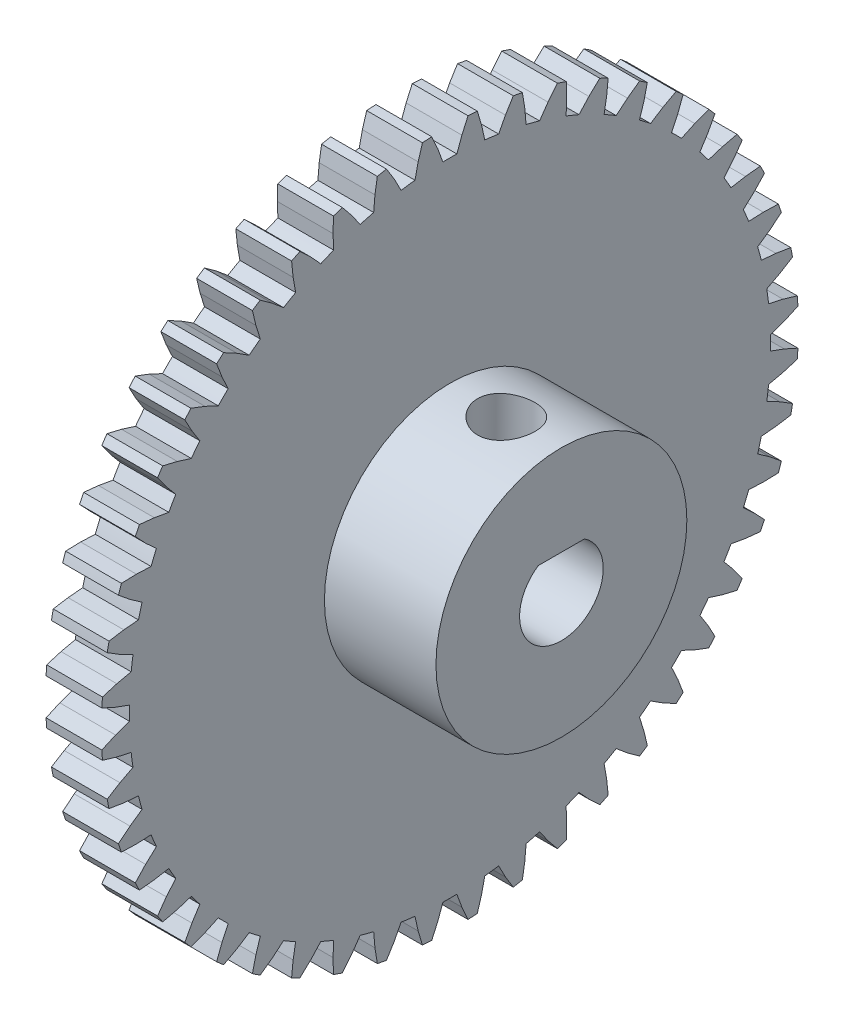
from build123d import *

# Parameters (mm, degrees)
BOSS_EXTRUDE1_DEPTH      = 2
SKETCH2_W                = 4
SKETCH2_H                = 4.5
F_3_0_3_DIAMETER_HOLE1_D = 3
BOSS_EXTRUDE2_START      = -6
BOSS_EXTRUDE2_DEPTH      = 6
SKETCH5_W                = 1.025
SKETCH5_H                = 3.404840194


with BuildPart() as part:
    # Sketch1 → Boss-Extrude1 (new body)
    with BuildSketch(Plane(origin=(2, 0, 0), x_dir=(0, 0, -1), z_dir=(1, 0, 0))):
        with BuildLine():
            Line((-11.497263311, -0.250871178), (-11.992256243, -0.431033871))
            Line((-11.992256243, -0.431033871), (-12.483028281, -0.651156621))
            ThreePointArc((-12.483028281, -0.651156621), (-12.473236541, -0.817539115), (-12.461227238, -0.983776262))
            Line((-12.461227238, -0.983776262), (-11.945922039, -1.137957227))
            Line((-11.945922039, -1.137957227), (-11.43164789, -1.251969061))
            ThreePointArc((-11.43164789, -1.251969061), (-11.401615906, -1.50105121), (-11.366157371, -1.749418939))
            Line((-11.366157371, -1.749418939), (-11.833399619, -1.99264986))
            Line((-11.833399619, -1.99264986), (-12.291241249, -2.274948035))
            ThreePointArc((-12.291241249, -2.274948035), (-12.259816005, -2.438629025), (-12.226211142, -2.601876461))
            Line((-12.226211142, -2.601876461), (-11.695189796, -2.687477561))
            Line((-11.695189796, -2.687477561), (-11.170433803, -2.733387762))
            ThreePointArc((-11.170433803, -2.733387762), (-11.108147002, -2.976419018), (-11.040573326, -3.21803366))
            Line((-11.040573326, -3.21803366), (-11.472070246, -3.520171058))
            Line((-11.472070246, -3.520171058), (-11.889147672, -3.859814457))
            ThreePointArc((-11.889147672, -3.859814457), (-11.836626619, -4.017993316), (-11.782001183, -4.175457834))
            Line((-11.782001183, -4.175457834), (-11.244349613, -4.191014409))
            Line((-11.244349613, -4.191014409), (-10.718090497, -4.16803744))
            ThreePointArc((-10.718090497, -4.16803744), (-10.624614624, -4.400859471), (-10.52608201, -4.631586932))
            Line((-10.52608201, -4.631586932), (-10.91445057, -4.987461152))
            Line((-10.91445057, -4.987461152), (-11.283627481, -5.378638384))
            ThreePointArc((-11.283627481, -5.378638384), (-11.210909269, -5.528608628), (-11.136197918, -5.677595965))
            Line((-11.136197918, -5.677595965), (-10.601115491, -5.622841839))
            Line((-10.601115491, -5.622841839), (-10.082357691, -5.531370843))
            ThreePointArc((-10.082357691, -5.531370843), (-9.959292144, -5.75), (-9.831486513, -5.965892468))
            Line((-9.831486513, -5.965892468), (-10.17008162, -6.369414404))
            Line((-10.17008162, -6.369414404), (-10.485041297, -6.805432316))
            ThreePointArc((-10.485041297, -6.805432316), (-10.393370154, -6.944627913), (-10.299851218, -7.082588855))
            Line((-10.299851218, -7.082588855), (-9.776493344, -6.958460886))
            Line((-9.776493344, -6.958460886), (-9.274112949, -6.800060956))
            ThreePointArc((-9.274112949, -6.800060956), (-9.123563413, -7.000756433), (-8.968671556, -7.19811993))
            Line((-8.968671556, -7.19811993), (-9.251699753, -7.642385209))
            Line((-9.251699753, -7.642385209), (-9.507053148, -8.115783415))
            ThreePointArc((-9.507053148, -8.115783415), (-9.397997593, -8.241822689), (-9.287271209, -8.366396686))
            Line((-9.287271209, -8.366396686), (-8.784592685, -8.175018738))
            Line((-8.784592685, -8.175018738), (-8.307185564, -7.952400141))
            ThreePointArc((-8.307185564, -7.952400141), (-8.131727984, -8.131727984), (-7.952400141, -8.307185564))
            Line((-7.952400141, -8.307185564), (-8.175018738, -8.784592685))
            Line((-8.175018738, -8.784592685), (-8.366396684, -9.28727121))
            ThreePointArc((-8.366396684, -9.28727121), (-8.241822688, -9.397997595), (-8.115783413, -9.50705315))
            Line((-8.115783413, -9.50705315), (-7.642385209, -9.251699753))
            Line((-7.642385209, -9.251699753), (-7.19811993, -8.968671556))
            ThreePointArc((-7.19811993, -8.968671556), (-7.000756433, -9.123563414), (-6.800060955, -9.27411295))
            Line((-6.800060955, -9.27411295), (-6.958460886, -9.776493344))
            Line((-6.958460886, -9.776493344), (-7.082588854, -10.299851219))
            ThreePointArc((-7.082588854, -10.299851219), (-6.944627914, -10.393370153), (-6.805432319, -10.485041295))
            Line((-6.805432319, -10.485041295), (-6.369414404, -10.17008162))
            Line((-6.369414404, -10.17008162), (-5.965892469, -9.831486513))
            ThreePointArc((-5.965892469, -9.831486513), (-5.749999999, -9.959292144), (-5.531370841, -10.082357691))
            Line((-5.531370841, -10.082357691), (-5.622841839, -10.601115491))
            Line((-5.622841839, -10.601115491), (-5.677595964, -11.136197918))
            ThreePointArc((-5.677595964, -11.136197918), (-5.528608629, -11.210909269), (-5.378638386, -11.28362748))
            Line((-5.378638386, -11.28362748), (-4.987461152, -10.91445057))
            Line((-4.987461152, -10.91445057), (-4.631586933, -10.52608201))
            ThreePointArc((-4.631586933, -10.52608201), (-4.400859471, -10.624614624), (-4.168037438, -10.718090498))
            Line((-4.168037438, -10.718090498), (-4.191014409, -11.244349613))
            Line((-4.191014409, -11.244349613), (-4.175457834, -11.782001183))
            ThreePointArc((-4.175457834, -11.782001183), (-4.017993317, -11.836626618), (-3.859814459, -11.889147671))
            Line((-3.859814459, -11.889147671), (-3.520171058, -11.472070246))
            Line((-3.520171058, -11.472070246), (-3.218033661, -11.040573325))
            ThreePointArc((-3.218033661, -11.040573325), (-2.97641902, -11.108147002), (-2.733387765, -11.170433802))
            Line((-2.733387765, -11.170433802), (-2.687477561, -11.695189796))
            Line((-2.687477561, -11.695189796), (-2.601876462, -12.226211142))
            ThreePointArc((-2.601876462, -12.226211142), (-2.438629026, -12.259816005), (-2.274948036, -12.291241249))
            Line((-2.274948036, -12.291241249), (-1.99264986, -11.833399619))
            Line((-1.99264986, -11.833399619), (-1.749418941, -11.36615737))
            ThreePointArc((-1.749418941, -11.36615737), (-1.501051212, -11.401615906), (-1.251969063, -11.431647889))
            Line((-1.251969063, -11.431647889), (-1.137957227, -11.945922038))
            Line((-1.137957227, -11.945922038), (-0.983776263, -12.461227238))
            ThreePointArc((-0.983776263, -12.461227238), (-0.817539116, -12.473236541), (-0.651156622, -12.483028281))
            Line((-0.651156622, -12.483028281), (-0.431033871, -11.992256243))
            Line((-0.431033871, -11.992256243), (-0.250871178, -11.497263311))
            ThreePointArc((-0.250871178, -11.497263311), (-1e-09, -11.5), (0.250871176, -11.497263311))
            Line((0.250871176, -11.497263311), (0.431033871, -11.992256243))
            Line((0.431033871, -11.992256243), (0.651156621, -12.483028281))
            ThreePointArc((0.651156621, -12.483028281), (0.817539115, -12.473236541), (0.983776263, -12.461227238))
            Line((0.983776263, -12.461227238), (1.137957227, -11.945922038))
            Line((1.137957227, -11.945922038), (1.251969061, -11.431647889))
            ThreePointArc((1.251969061, -11.431647889), (1.50105121, -11.401615906), (1.74941894, -11.36615737))
            Line((1.74941894, -11.36615737), (1.99264986, -11.833399619))
            Line((1.99264986, -11.833399619), (2.274948035, -12.291241249))
            ThreePointArc((2.274948035, -12.291241249), (2.438629025, -12.259816005), (2.601876463, -12.226211141))
            Line((2.601876463, -12.226211141), (2.687477561, -11.695189796))
            Line((2.687477561, -11.695189796), (2.733387762, -11.170433803))
            ThreePointArc((2.733387762, -11.170433803), (2.976419018, -11.108147002), (3.218033661, -11.040573325))
            Line((3.218033661, -11.040573325), (3.520171058, -11.472070246))
            Line((3.520171058, -11.472070246), (3.859814457, -11.889147672))
            ThreePointArc((3.859814457, -11.889147672), (4.017993317, -11.836626619), (4.175457835, -11.782001183))
            Line((4.175457835, -11.782001183), (4.191014409, -11.244349613))
            Line((4.191014409, -11.244349613), (4.16803744, -10.718090497))
            ThreePointArc((4.16803744, -10.718090497), (4.400859472, -10.624614624), (4.631586933, -10.52608201))
            Line((4.631586933, -10.52608201), (4.987461152, -10.91445057))
            Line((4.987461152, -10.91445057), (5.378638384, -11.283627481))
            ThreePointArc((5.378638384, -11.283627481), (5.528608629, -11.210909269), (5.677595966, -11.136197917))
            Line((5.677595966, -11.136197917), (5.622841839, -10.601115491))
            Line((5.622841839, -10.601115491), (5.531370843, -10.08235769))
            ThreePointArc((5.531370843, -10.08235769), (5.75, -9.959292143), (5.965892469, -9.831486512))
            Line((5.965892469, -9.831486512), (6.369414404, -10.17008162))
            Line((6.369414404, -10.17008162), (6.805432316, -10.485041296))
            ThreePointArc((6.805432316, -10.485041296), (6.944627914, -10.393370153), (7.082588856, -10.299851217))
            Line((7.082588856, -10.299851217), (6.958460886, -9.776493344))
            Line((6.958460886, -9.776493344), (6.800060956, -9.274112949))
            ThreePointArc((6.800060956, -9.274112949), (7.000756434, -9.123563413), (7.198119931, -8.968671555))
            Line((7.198119931, -8.968671555), (7.642385209, -9.251699753))
            Line((7.642385209, -9.251699753), (8.115783415, -9.507053148))
            ThreePointArc((8.115783415, -9.507053148), (8.241822687, -9.397997595), (8.366396682, -9.287271212))
            Line((8.366396682, -9.287271212), (8.175018738, -8.784592685))
            Line((8.175018738, -8.784592685), (7.952400141, -8.307185564))
            ThreePointArc((7.952400141, -8.307185564), (8.131727984, -8.131727983), (8.307185565, -7.95240014))
            Line((8.307185565, -7.95240014), (8.784592685, -8.175018738))
            Line((8.784592685, -8.175018738), (9.28727121, -8.366396684))
            ThreePointArc((9.28727121, -8.366396684), (9.397997593, -8.24182269), (9.507053146, -8.115783417))
            Line((9.507053146, -8.115783417), (9.251699753, -7.642385209))
            Line((9.251699753, -7.642385209), (8.968671556, -7.19811993))
            ThreePointArc((8.968671556, -7.19811993), (9.123563414, -7.000756432), (9.27411295, -6.800060954))
            Line((9.27411295, -6.800060954), (9.776493344, -6.958460886))
            Line((9.776493344, -6.958460886), (10.299851219, -7.082588854))
            ThreePointArc((10.299851219, -7.082588854), (10.393370153, -6.944627914), (10.485041295, -6.805432318))
            Line((10.485041295, -6.805432318), (10.17008162, -6.369414404))
            Line((10.17008162, -6.369414404), (9.831486513, -5.965892469))
            ThreePointArc((9.831486513, -5.965892469), (9.959292143, -5.750000001), (10.082357689, -5.531370845))
            Line((10.082357689, -5.531370845), (10.601115491, -5.622841839))
            Line((10.601115491, -5.622841839), (11.136197918, -5.677595964))
            ThreePointArc((11.136197918, -5.677595964), (11.210909269, -5.528608628), (11.283627481, -5.378638385))
            Line((11.283627481, -5.378638385), (10.91445057, -4.987461152))
            Line((10.91445057, -4.987461152), (10.52608201, -4.631586933))
            ThreePointArc((10.52608201, -4.631586933), (10.624614623, -4.400859473), (10.718090496, -4.168037442))
            Line((10.718090496, -4.168037442), (11.244349613, -4.191014409))
            Line((11.244349613, -4.191014409), (11.782001183, -4.175457834))
            ThreePointArc((11.782001183, -4.175457834), (11.836626619, -4.017993317), (11.889147671, -3.859814458))
            Line((11.889147671, -3.859814458), (11.472070246, -3.520171058))
            Line((11.472070246, -3.520171058), (11.040573325, -3.218033661))
            ThreePointArc((11.040573325, -3.218033661), (11.108147002, -2.976419019), (11.170433802, -2.733387763))
            Line((11.170433802, -2.733387763), (11.695189796, -2.687477561))
            Line((11.695189796, -2.687477561), (12.226211141, -2.601876462))
            ThreePointArc((12.226211141, -2.601876462), (12.259816005, -2.438629025), (12.291241249, -2.274948035))
            Line((12.291241249, -2.274948035), (11.833399619, -1.99264986))
            Line((11.833399619, -1.99264986), (11.36615737, -1.749418941))
            ThreePointArc((11.36615737, -1.749418941), (11.401615906, -1.501051211), (11.431647889, -1.251969062))
            Line((11.431647889, -1.251969062), (11.945922038, -1.137957227))
            Line((11.945922038, -1.137957227), (12.461227237, -0.983776263))
            ThreePointArc((12.461227237, -0.983776263), (12.47323654, -0.817539115), (12.483028281, -0.65115662))
            Line((12.483028281, -0.65115662), (11.992256243, -0.431033871))
            Line((11.992256243, -0.431033871), (11.497263311, -0.250871178))
            ThreePointArc((11.497263311, -0.250871178), (11.5, 0), (11.497263311, 0.250871178))
            Line((11.497263311, 0.250871178), (11.992256243, 0.431033871))
            Line((11.992256243, 0.431033871), (12.483028281, 0.651156622))
            ThreePointArc((12.483028281, 0.651156622), (12.47323654, 0.817539116), (12.461227237, 0.983776263))
            Line((12.461227237, 0.983776263), (11.945922038, 1.137957227))
            Line((11.945922038, 1.137957227), (11.431647889, 1.251969063))
            ThreePointArc((11.431647889, 1.251969063), (11.401615905, 1.501051212), (11.36615737, 1.749418941))
            Line((11.36615737, 1.749418941), (11.833399619, 1.99264986))
            Line((11.833399619, 1.99264986), (12.291241249, 2.274948036))
            ThreePointArc((12.291241249, 2.274948036), (12.259816005, 2.438629026), (12.226211141, 2.601876462))
            Line((12.226211141, 2.601876462), (11.695189796, 2.687477561))
            Line((11.695189796, 2.687477561), (11.170433802, 2.733387764))
            ThreePointArc((11.170433802, 2.733387764), (11.108147002, 2.97641902), (11.040573325, 3.218033661))
            Line((11.040573325, 3.218033661), (11.472070246, 3.520171058))
            Line((11.472070246, 3.520171058), (11.889147671, 3.859814459))
            ThreePointArc((11.889147671, 3.859814459), (11.836626618, 4.017993317), (11.782001183, 4.175457834))
            Line((11.782001183, 4.175457834), (11.244349613, 4.191014409))
            Line((11.244349613, 4.191014409), (10.718090498, 4.168037438))
            ThreePointArc((10.718090498, 4.168037438), (10.624614624, 4.400859471), (10.52608201, 4.631586933))
            Line((10.52608201, 4.631586933), (10.91445057, 4.987461152))
            Line((10.91445057, 4.987461152), (11.28362748, 5.378638386))
            ThreePointArc((11.28362748, 5.378638386), (11.210909269, 5.528608629), (11.136197918, 5.677595964))
            Line((11.136197918, 5.677595964), (10.601115491, 5.622841839))
            Line((10.601115491, 5.622841839), (10.082357691, 5.531370841))
            ThreePointArc((10.082357691, 5.531370841), (9.959292144, 5.749999999), (9.831486513, 5.965892469))
            Line((9.831486513, 5.965892469), (10.17008162, 6.369414404))
            Line((10.17008162, 6.369414404), (10.485041295, 6.805432319))
            ThreePointArc((10.485041295, 6.805432319), (10.393370153, 6.944627914), (10.299851219, 7.082588854))
            Line((10.299851219, 7.082588854), (9.776493344, 6.958460886))
            Line((9.776493344, 6.958460886), (9.27411295, 6.800060955))
            ThreePointArc((9.27411295, 6.800060955), (9.123563414, 7.000756433), (8.968671556, 7.19811993))
            Line((8.968671556, 7.19811993), (9.251699753, 7.642385209))
            Line((9.251699753, 7.642385209), (9.50705315, 8.115783413))
            ThreePointArc((9.50705315, 8.115783413), (9.397997595, 8.241822688), (9.28727121, 8.366396684))
            Line((9.28727121, 8.366396684), (8.784592685, 8.175018738))
            Line((8.784592685, 8.175018738), (8.307185564, 7.952400141))
            ThreePointArc((8.307185564, 7.952400141), (8.131727984, 8.131727983), (7.952400141, 8.307185564))
            Line((7.952400141, 8.307185564), (8.175018738, 8.784592685))
            Line((8.175018738, 8.784592685), (8.366396686, 9.287271208))
            ThreePointArc((8.366396686, 9.287271208), (8.241822689, 9.397997593), (8.115783415, 9.507053148))
            Line((8.115783415, 9.507053148), (7.642385209, 9.251699753))
            Line((7.642385209, 9.251699753), (7.19811993, 8.968671555))
            ThreePointArc((7.19811993, 8.968671555), (7.000756433, 9.123563413), (6.800060956, 9.274112949))
            Line((6.800060956, 9.274112949), (6.958460886, 9.776493344))
            Line((6.958460886, 9.776493344), (7.082588855, 10.299851218))
            ThreePointArc((7.082588855, 10.299851218), (6.944627913, 10.393370153), (6.805432316, 10.485041296))
            Line((6.805432316, 10.485041296), (6.369414404, 10.17008162))
            Line((6.369414404, 10.17008162), (5.965892468, 9.831486513))
            ThreePointArc((5.965892468, 9.831486513), (5.75, 9.959292143), (5.531370843, 10.08235769))
            Line((5.531370843, 10.08235769), (5.622841839, 10.601115491))
            Line((5.622841839, 10.601115491), (5.677595965, 11.136197918))
            ThreePointArc((5.677595965, 11.136197918), (5.528608628, 11.210909269), (5.378638384, 11.283627481))
            Line((5.378638384, 11.283627481), (4.987461152, 10.91445057))
            Line((4.987461152, 10.91445057), (4.631586932, 10.52608201))
            ThreePointArc((4.631586932, 10.52608201), (4.400859471, 10.624614624), (4.16803744, 10.718090497))
            Line((4.16803744, 10.718090497), (4.191014409, 11.244349613))
            Line((4.191014409, 11.244349613), (4.175457834, 11.782001183))
            ThreePointArc((4.175457834, 11.782001183), (4.017993316, 11.836626619), (3.859814457, 11.889147672))
            Line((3.859814457, 11.889147672), (3.520171058, 11.472070246))
            Line((3.520171058, 11.472070246), (3.21803366, 11.040573326))
            ThreePointArc((3.21803366, 11.040573326), (2.976419018, 11.108147002), (2.733387762, 11.170433803))
            Line((2.733387762, 11.170433803), (2.687477561, 11.695189796))
            Line((2.687477561, 11.695189796), (2.601876461, 12.226211142))
            ThreePointArc((2.601876461, 12.226211142), (2.438629025, 12.259816005), (2.274948035, 12.291241249))
            Line((2.274948035, 12.291241249), (1.99264986, 11.833399619))
            Line((1.99264986, 11.833399619), (1.749418939, 11.366157371))
            ThreePointArc((1.749418939, 11.366157371), (1.50105121, 11.401615906), (1.251969061, 11.431647889))
            Line((1.251969061, 11.431647889), (1.137957227, 11.945922038))
            Line((1.137957227, 11.945922038), (0.983776262, 12.461227238))
            ThreePointArc((0.983776262, 12.461227238), (0.817539115, 12.473236541), (0.651156621, 12.483028281))
            Line((0.651156621, 12.483028281), (0.431033871, 11.992256243))
            Line((0.431033871, 11.992256243), (0.250871175, 11.497263311))
            ThreePointArc((0.250871175, 11.497263311), (-1e-09, 11.5), (-0.250871178, 11.497263311))
            Line((-0.250871178, 11.497263311), (-0.431033871, 11.992256243))
            Line((-0.431033871, 11.992256243), (-0.651156623, 12.483028281))
            ThreePointArc((-0.651156623, 12.483028281), (-0.817539116, 12.473236541), (-0.983776263, 12.461227238))
            Line((-0.983776263, 12.461227238), (-1.137957227, 11.945922038))
            Line((-1.137957227, 11.945922038), (-1.251969058, 11.43164789))
            ThreePointArc((-1.251969058, 11.43164789), (-1.501051209, 11.401615906), (-1.749418941, 11.36615737))
            Line((-1.749418941, 11.36615737), (-1.99264986, 11.833399619))
            Line((-1.99264986, 11.833399619), (-2.274948037, 12.291241249))
            ThreePointArc((-2.274948037, 12.291241249), (-2.438629026, 12.259816005), (-2.601876462, 12.226211142))
            Line((-2.601876462, 12.226211142), (-2.687477561, 11.695189796))
            Line((-2.687477561, 11.695189796), (-2.73338776, 11.170433803))
            ThreePointArc((-2.73338776, 11.170433803), (-2.976419018, 11.108147002), (-3.218033661, 11.040573325))
            Line((-3.218033661, 11.040573325), (-3.520171058, 11.472070246))
            Line((-3.520171058, 11.472070246), (-3.85981446, 11.889147671))
            ThreePointArc((-3.85981446, 11.889147671), (-4.017993318, 11.836626618), (-4.175457834, 11.782001183))
            Line((-4.175457834, 11.782001183), (-4.191014409, 11.244349613))
            Line((-4.191014409, 11.244349613), (-4.168037439, 10.718090497))
            ThreePointArc((-4.168037439, 10.718090497), (-4.400859471, 10.624614624), (-4.631586933, 10.52608201))
            Line((-4.631586933, 10.52608201), (-4.987461152, 10.91445057))
            Line((-4.987461152, 10.91445057), (-5.378638382, 11.283627482))
            ThreePointArc((-5.378638382, 11.283627482), (-5.528608627, 11.21090927), (-5.677595964, 11.136197918))
            Line((-5.677595964, 11.136197918), (-5.622841839, 10.601115491))
            Line((-5.622841839, 10.601115491), (-5.531370842, 10.082357691))
            ThreePointArc((-5.531370842, 10.082357691), (-5.75, 9.959292144), (-5.965892469, 9.831486513))
            Line((-5.965892469, 9.831486513), (-6.369414404, 10.17008162))
            Line((-6.369414404, 10.17008162), (-6.805432315, 10.485041298))
            ThreePointArc((-6.805432315, 10.485041298), (-6.944627912, 10.393370154), (-7.082588854, 10.299851219))
            Line((-7.082588854, 10.299851219), (-6.958460886, 9.776493344))
            Line((-6.958460886, 9.776493344), (-6.800060956, 9.274112949))
            ThreePointArc((-6.800060956, 9.274112949), (-7.000756433, 9.123563414), (-7.19811993, 8.968671556))
            Line((-7.19811993, 8.968671556), (-7.642385209, 9.251699753))
            Line((-7.642385209, 9.251699753), (-8.115783414, 9.507053149))
            ThreePointArc((-8.115783414, 9.507053149), (-8.241822688, 9.397997594), (-8.366396684, 9.28727121))
            Line((-8.366396684, 9.28727121), (-8.175018738, 8.784592685))
            Line((-8.175018738, 8.784592685), (-7.952400142, 8.307185564))
            ThreePointArc((-7.952400142, 8.307185564), (-8.131727984, 8.131727983), (-8.307185564, 7.952400141))
            Line((-8.307185564, 7.952400141), (-8.784592685, 8.175018738))
            Line((-8.784592685, 8.175018738), (-9.287271209, 8.366396685))
            ThreePointArc((-9.287271209, 8.366396685), (-9.397997594, 8.241822689), (-9.507053148, 8.115783415))
            Line((-9.507053148, 8.115783415), (-9.251699753, 7.642385209))
            Line((-9.251699753, 7.642385209), (-8.968671556, 7.198119929))
            ThreePointArc((-8.968671556, 7.198119929), (-9.123563414, 7.000756433), (-9.274112949, 6.800060956))
            Line((-9.274112949, 6.800060956), (-9.776493344, 6.958460886))
            Line((-9.776493344, 6.958460886), (-10.299851219, 7.082588854))
            ThreePointArc((-10.299851219, 7.082588854), (-10.393370154, 6.944627913), (-10.485041297, 6.805432316))
            Line((-10.485041297, 6.805432316), (-10.17008162, 6.369414404))
            Line((-10.17008162, 6.369414404), (-9.831486514, 5.965892468))
            ThreePointArc((-9.831486514, 5.965892468), (-9.959292144, 5.749999999), (-10.082357691, 5.531370843))
            Line((-10.082357691, 5.531370843), (-10.601115491, 5.622841839))
            Line((-10.601115491, 5.622841839), (-11.136197918, 5.677595964))
            ThreePointArc((-11.136197918, 5.677595964), (-11.210909269, 5.528608628), (-11.283627481, 5.378638384))
            Line((-11.283627481, 5.378638384), (-10.91445057, 4.987461152))
            Line((-10.91445057, 4.987461152), (-10.526082011, 4.631586931))
            ThreePointArc((-10.526082011, 4.631586931), (-10.624614624, 4.400859471), (-10.718090497, 4.16803744))
            Line((-10.718090497, 4.16803744), (-11.244349613, 4.191014409))
            Line((-11.244349613, 4.191014409), (-11.782001184, 4.175457833))
            ThreePointArc((-11.782001184, 4.175457833), (-11.836626619, 4.017993316), (-11.889147672, 3.859814457))
            Line((-11.889147672, 3.859814457), (-11.472070246, 3.520171058))
            Line((-11.472070246, 3.520171058), (-11.040573326, 3.218033659))
            ThreePointArc((-11.040573326, 3.218033659), (-11.108147003, 2.976419018), (-11.170433803, 2.733387762))
            Line((-11.170433803, 2.733387762), (-11.695189796, 2.687477561))
            Line((-11.695189796, 2.687477561), (-12.226211142, 2.60187646))
            ThreePointArc((-12.226211142, 2.60187646), (-12.259816005, 2.438629024), (-12.291241249, 2.274948035))
            Line((-12.291241249, 2.274948035), (-11.833399619, 1.99264986))
            Line((-11.833399619, 1.99264986), (-11.36615737, 1.749418944))
            ThreePointArc((-11.36615737, 1.749418944), (-11.401615906, 1.501051212), (-11.43164789, 1.251969061))
            Line((-11.43164789, 1.251969061), (-11.945922038, 1.137957227))
            Line((-11.945922038, 1.137957227), (-12.461227238, 0.983776261))
            ThreePointArc((-12.461227238, 0.983776261), (-12.473236541, 0.817539114), (-12.483028281, 0.651156621))
            Line((-12.483028281, 0.651156621), (-11.992256243, 0.431033871))
            Line((-11.992256243, 0.431033871), (-11.497263311, 0.25087118))
            ThreePointArc((-11.497263311, 0.25087118), (-11.5, 1e-09), (-11.497263311, -0.250871178))
        make_face()
    extrude(amount=-BOSS_EXTRUDE1_DEPTH)

    # Sketch2 → Revolve1 (revolve)
    with BuildSketch(Plane.XY, mode=Mode.PRIVATE) as revolve1_sk:
        with Locations((4, 2.25)):
            Rectangle(SKETCH2_W, SKETCH2_H)
    revolve(revolve1_sk.sketch.rotate(Axis((2, 0, 0), (1, 0, 0)), 270), axis=Axis((2, 0, 0), (1, 0, 0)))

    # Ø3.0 (3) Diameter Hole1 (through all)
    with Locations(Plane(origin=(6, 0, 0), x_dir=(0, 0, -1), z_dir=(1, 0, 0))):
        with Locations((0, 0)):
            Hole(F_3_0_3_DIAMETER_HOLE1_D / 2)

    # Sketch7 → Boss-Extrude2 (add)
    with BuildSketch(Plane(origin=(6, 0, 0), x_dir=(0, 0, -1), z_dir=(1, 0, 0)).offset(BOSS_EXTRUDE2_START)):
        with BuildLine():
            ThreePointArc((0.829156198, 1.25), (0, 1.5), (-0.829156198, 1.25))
            Line((-0.829156198, 1.25), (0.829156198, 1.25))
        make_face()
    extrude(amount=BOSS_EXTRUDE2_DEPTH)

    # Sketch5 → M2.5x0.45 Tapped Hole1 (revolve, cut)
    with BuildSketch(Plane(origin=(4, 1.095142532, -0.006150956), x_dir=(0, -0.0056164917039993115, -0.999984227386082), z_dir=(1, 0, 0))):
        with Locations((0.5125, 1.702420097)):
            Rectangle(SKETCH5_W, SKETCH5_H)
    revolve(axis=Axis((4, -5.254757312, 0.029513766), (0, 0.9999842273860818, -0.005616491703999311)), mode=Mode.SUBTRACT)


solid = part.part
